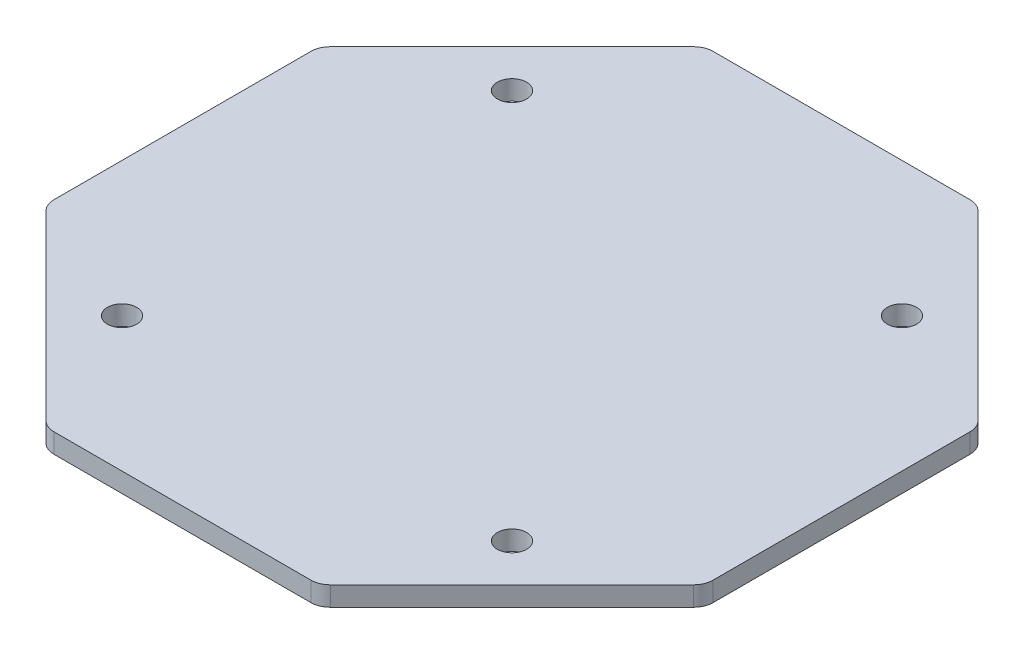
from build123d import *

# Parameters (mm, degrees)
BOSS_EXTRUDE1_DEPTH = 2
FILLET1_R           = 2
SKETCH2_R           = 1.5
CUT_EXTRUDE1_DEPTH  = 10


with BuildPart() as part:
    # Sketch1 → Boss-Extrude1 (new body)
    with BuildSketch(Plane(origin=(0, 0, 0), x_dir=(1, 0, 0), z_dir=(0, 1, 0))):
        Polygon((-14, 33.798989873), (14, 33.798989873), (33.798989873, 14), (33.798989873, -14), (14, -33.798989873), (-14, -33.798989873), (-33.798989873, -14), (-33.798989873, 14), align=None)
    extrude(amount=BOSS_EXTRUDE1_DEPTH)

    # Fillet1
    fillet1_edges = [part.edges().sort_by_distance(p)[0] for p in [
        (-14, 1, -33.798989873),
        (14, 1, -33.798989873),
        (33.798989873, 1, -14),
        (33.798989873, 1, 14),
        (14, 1, 33.798989873),
        (-14, 1, 33.798989873),
        (-33.798989873, 1, 14),
        (-33.798989873, 1, -14),
    ]]
    fillet(fillet1_edges, radius=FILLET1_R)

    # Sketch2 → Cut-Extrude1 (cut)
    with BuildSketch(Plane(origin=(0, 2, 0), x_dir=(1, 0, 0), z_dir=(0, 1, 0))):
        with Locations(Location((-20, 20, 0), (0, 0, 270))):
            Circle(SKETCH2_R)
        with Locations(Location((20, 20, 0), (0, 0, 270))):
            Circle(SKETCH2_R)
        with Locations(Location((20, -20, 0), (0, 0, 270))):
            Circle(SKETCH2_R)
        with Locations(Location((-20, -20, 0), (0, 0, 270))):
            Circle(SKETCH2_R)
    extrude(amount=-CUT_EXTRUDE1_DEPTH, mode=Mode.SUBTRACT)


solid = part.part
